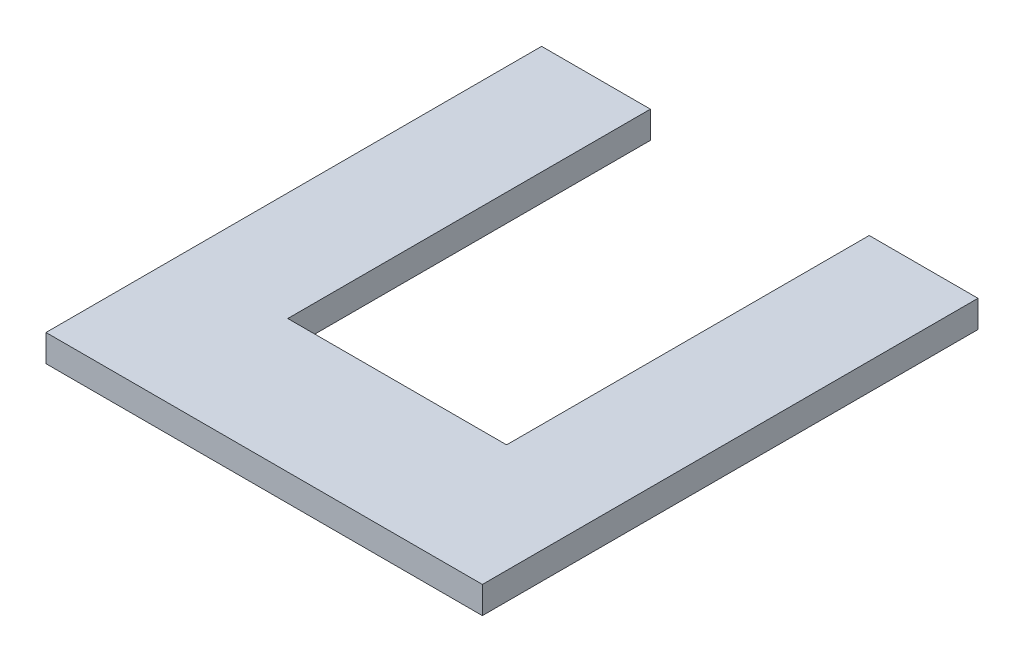
from build123d import *

# Parameters (mm, degrees)
SALIENTE_EXTRUIR1_DEPTH = 5


with BuildPart() as part:
    # Croquis1 → Saliente-Extruir1 (new body)
    with BuildSketch(Plane(origin=(0, 0, 0), x_dir=(1, 0, 0), z_dir=(0, 1, 0))):
        Polygon((80.627338956, 0), (80.627338956, 91.567), (60.528766848, 91.567), (60.528766848, 24.567), (20.099059607, 24.567), (20.099059607, 91.567), (0, 91.567), (0, 0), align=None)
    extrude(amount=SALIENTE_EXTRUIR1_DEPTH)


solid = part.part
